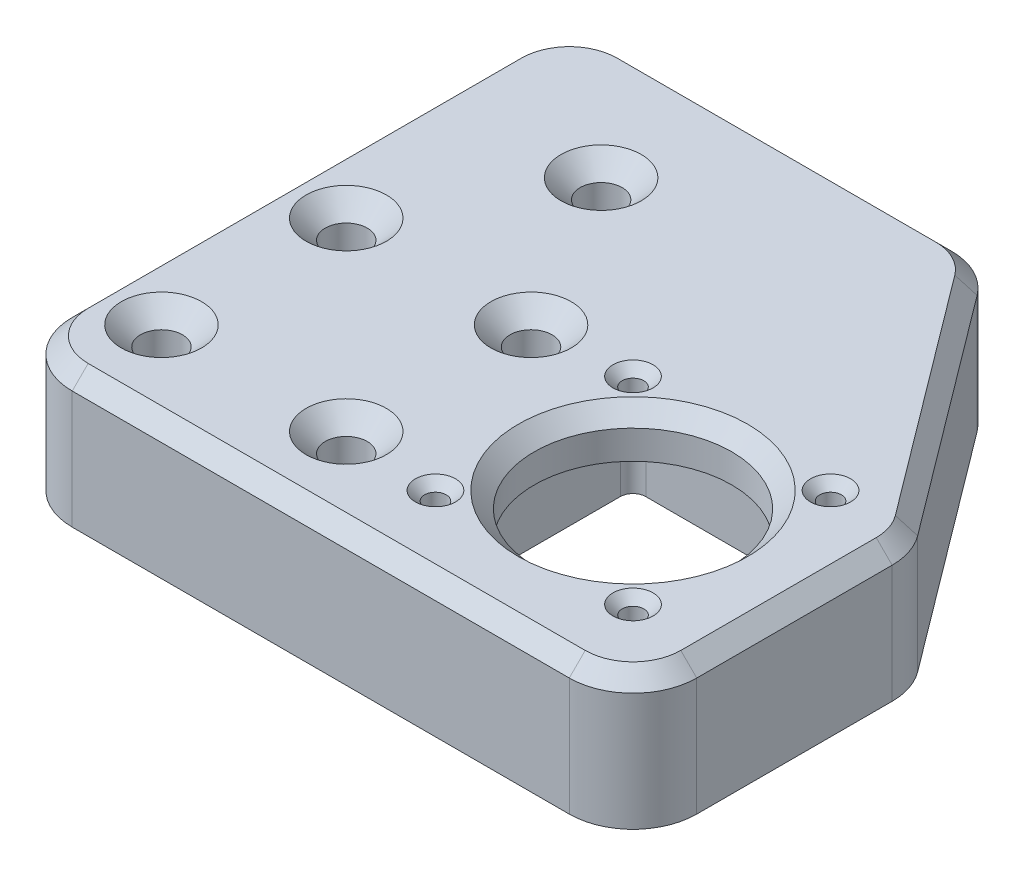
from build123d import *

# Parameters (mm, degrees)
SKETCH_1_W                 = 80
SKETCH_1_H                 = 80
EXTRUDE_278_DEPTH          = 21
EXTRUDE_2_DEPTH            = 21
HOLE_WIZARD_M6_D           = 6.6
HOLE_WIZARD_M6_CSINK_D     = 12.6
HOLE_WIZARD_M6_CSINK_ANGLE = 90
SKETCH_10_W                = 40
SKETCH_10_H                = 40
CUT_EXTRUDE_40_DEPTH       = 11.5
SKETCH_11_W                = 42.3
SKETCH_11_H                = 42.3
NEMA17_DEPTH               = 14
NEMA17_M3_D                = 3.4
NEMA17_M3_CSINK_D          = 6.3
NEMA17_M3_CSINK_ANGLE      = 90
FILLET_1_R                 = 2
SKETCH_14_R                = 15.5
NEMA23_DEPTH               = 106.588825166
SKETCH_2_W                 = 35
SKETCH_2_H                 = 88
CUT_EXTRUDE_4267_DEPTH     = 107.742681248
CUT_EXTRUDE_1_DEPTH        = 107.742681248
FILLET_2_R                 = 10
CHAMFER_1_SIZE             = 2.5


with BuildPart() as part:
    # Эскиз1 → Extrude 278 (new body)
    with BuildSketch(Plane(origin=(0, 0, 0), x_dir=(1, 0, 0), z_dir=(0, 1, 0))):
        Rectangle(SKETCH_1_W, SKETCH_1_H)
    extrude(amount=EXTRUDE_278_DEPTH)

    # Эскиз9 → База-2 (add)
    with BuildSketch(Plane(origin=(0, 21, 0), x_dir=(1, 0, 0), z_dir=(0, 1, 0))):
        Polygon((40, 40), (93, 40), (93, -48), (-40, -48), (-40, -40), (40, -40), align=None)
    extrude(amount=-EXTRUDE_2_DEPTH)

    # Крепление-M6 (through all)
    with Locations(Plane(origin=(0, 21, 0), x_dir=(1, 0, 0), z_dir=(0, 1, 0))):
        with Locations((-20, -20), (20, 20), (5.5, -5.5), (34.5, -5.5), (34.5, -34.5), (5.5, -34.5)):
            CounterSinkHole(HOLE_WIZARD_M6_D / 2, HOLE_WIZARD_M6_CSINK_D / 2, counter_sink_angle=HOLE_WIZARD_M6_CSINK_ANGLE)

    # Эскиз10 → Профиль-40 (cut)
    with BuildSketch(Plane.XZ):
        with Locations((20, 20)):
            Rectangle(SKETCH_10_W, SKETCH_10_H)
    extrude(amount=-CUT_EXTRUDE_40_DEPTH, mode=Mode.SUBTRACT)

    # Эскиз11 → Nema17 (cut)
    with BuildSketch(Plane.XZ):
        with Locations((65, 20)):
            Rectangle(SKETCH_11_W, SKETCH_11_H)
    extrude(amount=-NEMA17_DEPTH, mode=Mode.SUBTRACT)

    # Nema17-M3 (through all)
    with Locations(Plane(origin=(0, 21, 0), x_dir=(-1, 0, 0), z_dir=(0, 1, 0))):
        with Locations((-49.5, 35.5), (-80.5, 35.5), (-80.5, 4.5), (-49.5, 4.5)):
            CounterSinkHole(NEMA17_M3_D / 2, NEMA17_M3_CSINK_D / 2, counter_sink_angle=NEMA17_M3_CSINK_ANGLE)

    # Скругление1
    fillet_1_edges = [part.edges().sort_by_distance(p)[0] for p in [
        (0, 5.75, 0),
        (0, 5.75, 40),
        (40, 5.75, 40),
        (40, 5.75, 0),
        (86.15, 7, 41.15),
        (86.15, 7, -1.15),
        (43.85, 7, -1.15),
        (43.85, 7, 41.15),
    ]]
    fillet(fillet_1_edges, radius=FILLET_1_R)

    # Эскиз14 → Вырез-Nema23 (cut, through all)
    with BuildSketch(Plane.XZ.offset(-14)):
        with Locations(Location((65, 20, 0), (0, 0, 270))):
            Circle(SKETCH_14_R)
    extrude(amount=-NEMA23_DEPTH, mode=Mode.SUBTRACT)

    # Эскиз2 → Cut-Extrude 4267 (cut, through all)
    with BuildSketch(Plane(origin=(0, 21, 0), x_dir=(1, 0, 0), z_dir=(0, 1, 0))):
        with Locations((-22.5, -4)):
            Rectangle(SKETCH_2_W, SKETCH_2_H)
    extrude(amount=-CUT_EXTRUDE_4267_DEPTH, mode=Mode.SUBTRACT)

    # Эскиз15 → Вырез-Вытянуть1 (cut, through all)
    with BuildSketch(Plane(origin=(0, 21, 0), x_dir=(1, 0, 0), z_dir=(0, 1, 0))):
        Polygon((60, 40), (93, -4), (93, 40), align=None)
    extrude(amount=-CUT_EXTRUDE_1_DEPTH, mode=Mode.SUBTRACT)

    # Скругление2
    fillet_2_edges = [part.edges().sort_by_distance(p)[0] for p in [
        (93, 10.5, 48),
        (-5, 10.5, -40),
        (-5, 10.5, 48),
        (60, 10.5, -40),
        (93, 10.5, 4),
    ]]
    fillet(fillet_2_edges, radius=FILLET_2_R)

    # Фаска1
    chamfer_1_edges = [part.edges().sort_by_distance(p)[0] for p in [
        (65, 21, 35.5),
        (93, 21, 22.666666667),
        (77, 21, -17.333333333),
        (30, 21, -40),
        (-5, 21, 4),
        (44, 21, 48),
        (-2.071067812, 21, 45.071067812),
        (90.071067812, 21, 45.071067812),
        (-2.071067812, 21, -37.071067812),
        (59.472135955, 21, -38.94427191),
        (92.486832981, 21, 4.171055673),
    ]]
    chamfer(chamfer_1_edges, length=CHAMFER_1_SIZE)


solid = part.part
